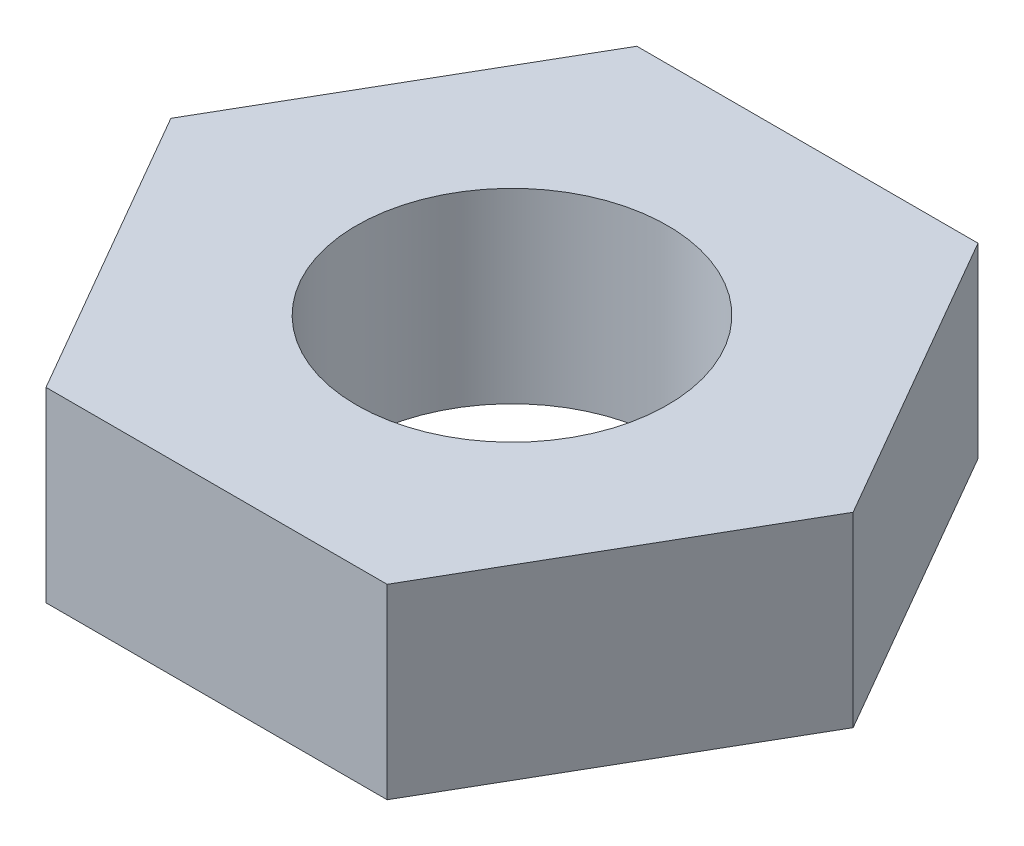
from build123d import *

# Parameters (mm, degrees)
SKETCH1_R           = 1
BOSS_EXTRUDE1_DEPTH = 1.2


with BuildPart() as part:
    # Sketch1 → Boss-Extrude1 (new body)
    with BuildSketch(Plane(origin=(0, 0, 0), x_dir=(1, 0, 0), z_dir=(0, 1, 0))):
        Polygon((1.096965511, 1.9), (-1.096965511, 1.9), (-2.193931023, 0), (-1.096965511, -1.9), (1.096965511, -1.9), (2.193931023, 0), align=None)
        with Locations(Location((0, 0, 0), (0, 0, 270))):
            Circle(SKETCH1_R, mode=Mode.SUBTRACT)
    extrude(amount=BOSS_EXTRUDE1_DEPTH)


solid = part.part
